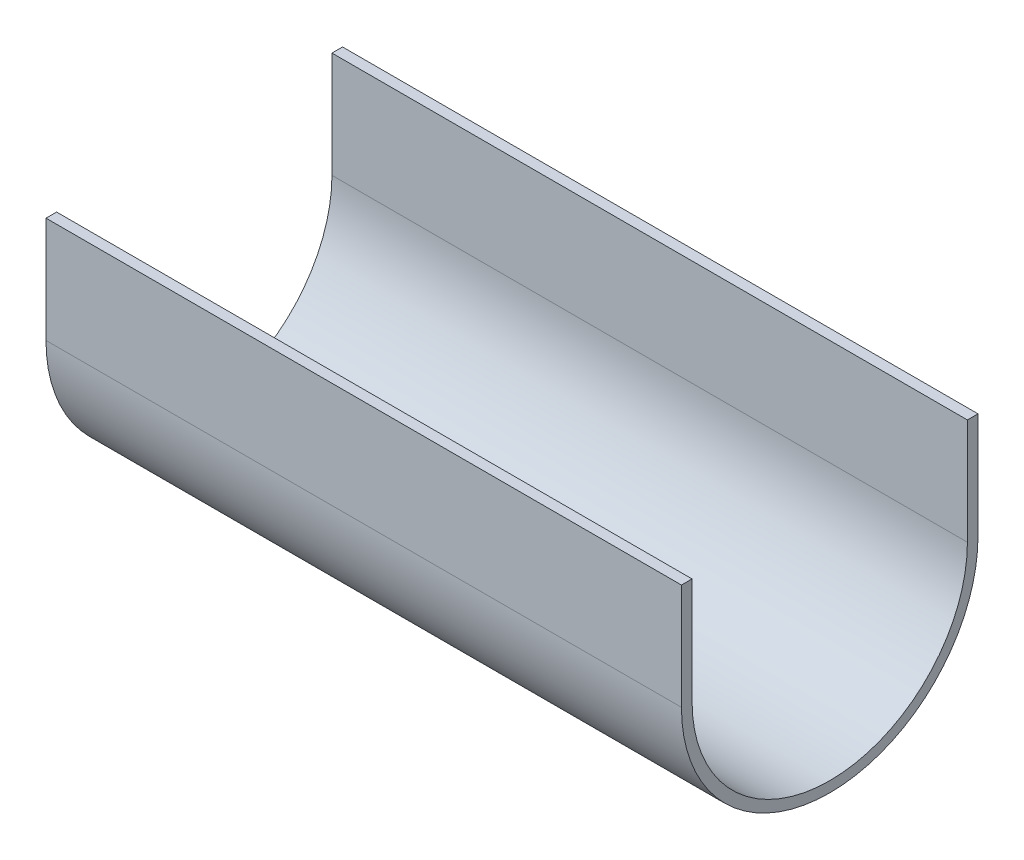
from build123d import *

# Parameters (mm, degrees)
BOSS_EXTRUDE1_DEPTH = 120
SKETCH2_W           = 120
SKETCH2_H           = 2
BOSS_EXTRUDE2_DEPTH = 20


with BuildPart() as part:
    # Sketch1 → Boss-Extrude1 (new body)
    with BuildSketch(Plane(origin=(0, 0, 0), x_dir=(0, 0, -1), z_dir=(1, 0, 0))):
        with BuildLine():
            Line((26, 0), (28, 0))
            ThreePointArc((28, 0), (0, -28), (-28, 0))
            Line((-28, 0), (-26, 0))
            ThreePointArc((-26, 0), (0, -26), (26, 0))
        make_face()
    extrude(amount=BOSS_EXTRUDE1_DEPTH)

    # Sketch2 → Boss-Extrude2 (add)
    with BuildSketch(Plane(origin=(0, 0, 0), x_dir=(1, 0, 0), z_dir=(0, 1, 0))):
        with Locations((60, 27)):
            Rectangle(SKETCH2_W, SKETCH2_H)
        with Locations((60, -27)):
            Rectangle(SKETCH2_W, SKETCH2_H)
    extrude(amount=BOSS_EXTRUDE2_DEPTH)


solid = part.part
